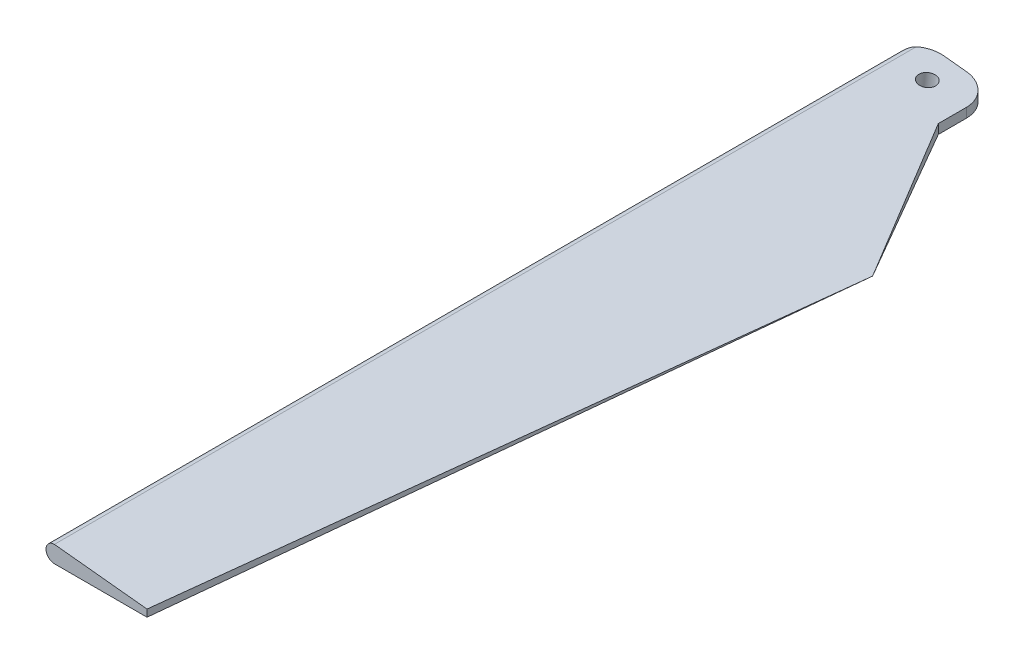
from build123d import *

# Parameters (mm, degrees)
SALIENTE_EXTRUIR1_DEPTH = 155
CORTAR_EXTRUIR6_DEPTH   = 155
CROQUIS5_R              = 1.5
CORTAR_EXTRUIR9_DEPTH   = 155


with BuildPart() as part:
    # Croquis1 → Saliente-Extruir1 (new body)
    with BuildSketch(Plane.XY):
        with BuildLine():
            Line((0, 0), (28.5, 0))
            Line((28.5, 0), (0, 3))
            ThreePointArc((0, 3), (-1.5, 1.5), (0, 0))
        make_face()
    extrude(amount=-SALIENTE_EXTRUIR1_DEPTH)

    # Croquis3 → Cortar-Extruir6 (cut)
    with BuildSketch(Plane(origin=(0, 0, 0), x_dir=(1, 0, 0), z_dir=(0, 1, 0))):
        Polygon((28.5, 0), (28.5, 117.287187079), (16.5, 0), align=None)
        with BuildLine():
            ThreePointArc((7.5, 155), (11.035533906, 153.535533906), (12.5, 150))
            Line((12.5, 150), (12.5, 145))
            Line((12.5, 145), (28.5, 117.287187079))
            Line((28.5, 117.287187079), (28.5, 155))
            Line((28.5, 155), (7.5, 155))
        make_face()
        with BuildLine():
            ThreePointArc((3.5, 155), (-0.035533906, 153.535533906), (-1.5, 150))
            Line((-1.5, 150), (-1.5, 155))
            Line((-1.5, 155), (3.5, 155))
        make_face()
    extrude(amount=CORTAR_EXTRUIR6_DEPTH, mode=Mode.SUBTRACT)

    # Croquis5 → Cortar-Extruir9 (cut)
    with BuildSketch(Plane(origin=(0.312328767, 2.967123288, 0), x_dir=(0.9945054529214061, -0.10468478451804268, 0), z_dir=(0.10468478451804267, 0.994505452921406, 0))):
        with Locations(Location((5.255006945, 150, 0), (0, 0, 180))):
            Circle(CROQUIS5_R)
    extrude(amount=-CORTAR_EXTRUIR9_DEPTH, mode=Mode.SUBTRACT)


solid = part.part
